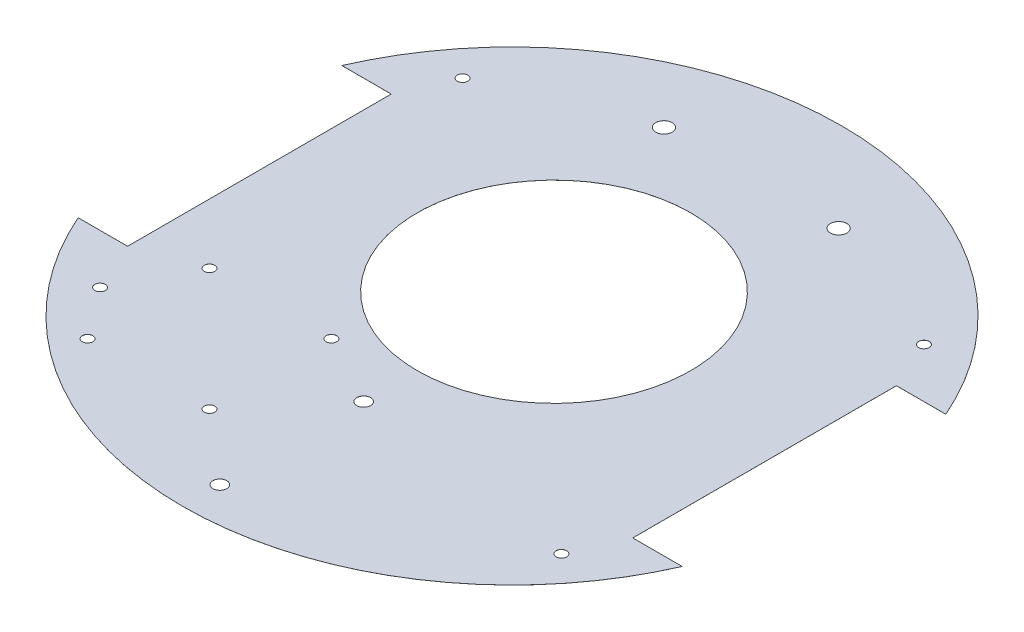
from build123d import *

# Parameters (mm, degrees)
SKETCH_2_R               = 1.6
SKETCH_2_R_2             = 2.1
SKETCH_2_R_3             = 41.5
EXTRUDE_1_DEPTH          = 0.01
CUT_EXTRUDE_8_DEPTH      = 136.646600031
CUT_EXTRUDE_8_DEPTH_BACK = 136.646600031
SKETCH_6_R               = 1.6
CUT_EXTRUDE_9_DEPTH      = 136.646600031
CUT_EXTRUDE_9_DEPTH_BACK = 136.646600031
SKETCH_7_R               = 2.5


with BuildPart() as part:
    # 草圖2 → 填料-伸長1 (new body)
    with BuildSketch(Plane(origin=(0, 0, 0), x_dir=(1, 0, 0), z_dir=(0, 1, 0))):
        with BuildLine():
            Line((76.651513899, -40), (76.651513899, 40))
            Line((76.651513899, 40), (91.651513899, 40))
            ThreePointArc((91.651513899, 40), (0, 100), (-91.651513899, 40))
            Line((-91.651513899, 40), (-76.651513899, 40))
            Line((-76.651513899, 40), (-76.651513899, -40))
            Line((-76.651513899, -40), (-91.651513899, -40))
            ThreePointArc((-91.651513899, -40), (0, -100), (91.651513899, -40))
            Line((91.651513899, -40), (76.651513899, -40))
        make_face()
        with Locations((-70, -55)):
            Circle(SKETCH_2_R, mode=Mode.SUBTRACT)
        with Locations((0, -88.65)):
            Circle(SKETCH_2_R_2, mode=Mode.SUBTRACT)
        with Locations((70, -55)):
            Circle(SKETCH_2_R, mode=Mode.SUBTRACT)
        with Locations((0, -45)):
            Circle(SKETCH_2_R_2, mode=Mode.SUBTRACT)
        with Locations((-70, 55)):
            Circle(SKETCH_2_R, mode=Mode.SUBTRACT)
        with Locations((0, 12.743545883)):
            Circle(SKETCH_2_R_3, mode=Mode.SUBTRACT)
        with Locations((70, 55)):
            Circle(SKETCH_2_R, mode=Mode.SUBTRACT)
    extrude(amount=EXTRUDE_1_DEPTH)

    # 草圖6 → 除料-伸長8 (cut, two sides: drawn at the far end of the back side and taken through both)
    with BuildSketch(Plane(origin=(0, 0.01, 0), x_dir=(1, 0, 0), z_dir=(0, 1, 0)).offset(-CUT_EXTRUDE_8_DEPTH_BACK)):
        with Locations((-58.41813564, -33.374946877)):
            Circle(SKETCH_6_R)
        with Locations((-21.41813564, -33.374946877)):
            Circle(SKETCH_6_R)
        with Locations((-58.41813564, -70.374946877)):
            Circle(SKETCH_6_R)
        with Locations((-21.41813564, -70.374946877)):
            Circle(SKETCH_6_R)
    extrude(amount=CUT_EXTRUDE_8_DEPTH + CUT_EXTRUDE_8_DEPTH_BACK, mode=Mode.SUBTRACT)

    # 草圖7 → 除料-伸長9 (cut, two sides: drawn at the far end of the back side and taken through both)
    with BuildSketch(Plane(origin=(0, 0.01, 0), x_dir=(1, 0, 0), z_dir=(0, 1, 0)).offset(-CUT_EXTRUDE_9_DEPTH_BACK)):
        with Locations((-26.5, 72.61491789)):
            Circle(SKETCH_7_R)
        with Locations((26.5, 72.61491789)):
            Circle(SKETCH_7_R)
    extrude(amount=CUT_EXTRUDE_9_DEPTH + CUT_EXTRUDE_9_DEPTH_BACK, mode=Mode.SUBTRACT)


solid = part.part
